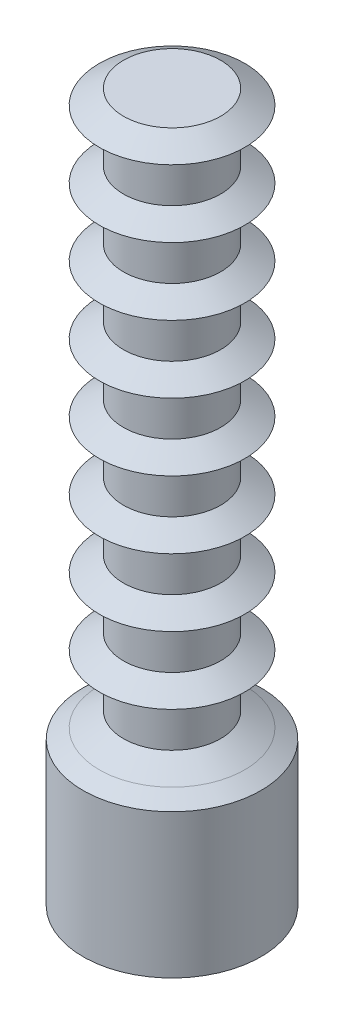
from build123d import *


with BuildPart() as part:
    # Sketch1 → Revolve2 (revolve)
    with BuildSketch(Plane.XY, mode=Mode.PRIVATE) as revolve2_sk:
        Polygon((-1.231630681, 0), (-5.431630681, 0), (-5.431630681, 33.4), (-3.138866015, 33.4), (-1.995791511, 32.7), (-3.138866015, 32.014155298), (-3.138866015, 30.22), (-1.995791511, 29.52), (-3.138866015, 28.834155298), (-3.138866015, 27.04), (-1.995791511, 26.34), (-3.138866015, 25.654155298), (-3.138866015, 23.86), (-1.995791511, 23.16), (-3.138866015, 22.474155298), (-3.138866015, 20.68), (-1.995791511, 19.98), (-3.138866015, 19.294155298), (-3.138866015, 17.5), (-1.995791511, 16.8), (-3.138866015, 16.114155298), (-3.138866015, 14.32), (-1.995791511, 13.62), (-3.138866015, 12.934155298), (-3.138866015, 11.14), (-1.995791511, 10.44), (-3.138866015, 9.754155298), (-3.138866015, 7.96), (-1.995791511, 7.26), (-1.231630681, 6.795995819), align=None)
    revolve(revolve2_sk.sketch.rotate(Axis((-5.431630681, 34.2, 0), (0, -1, 0)), 180), axis=Axis((-5.431630681, 34.2, 0), (0, -1, 0)))


solid = part.part
